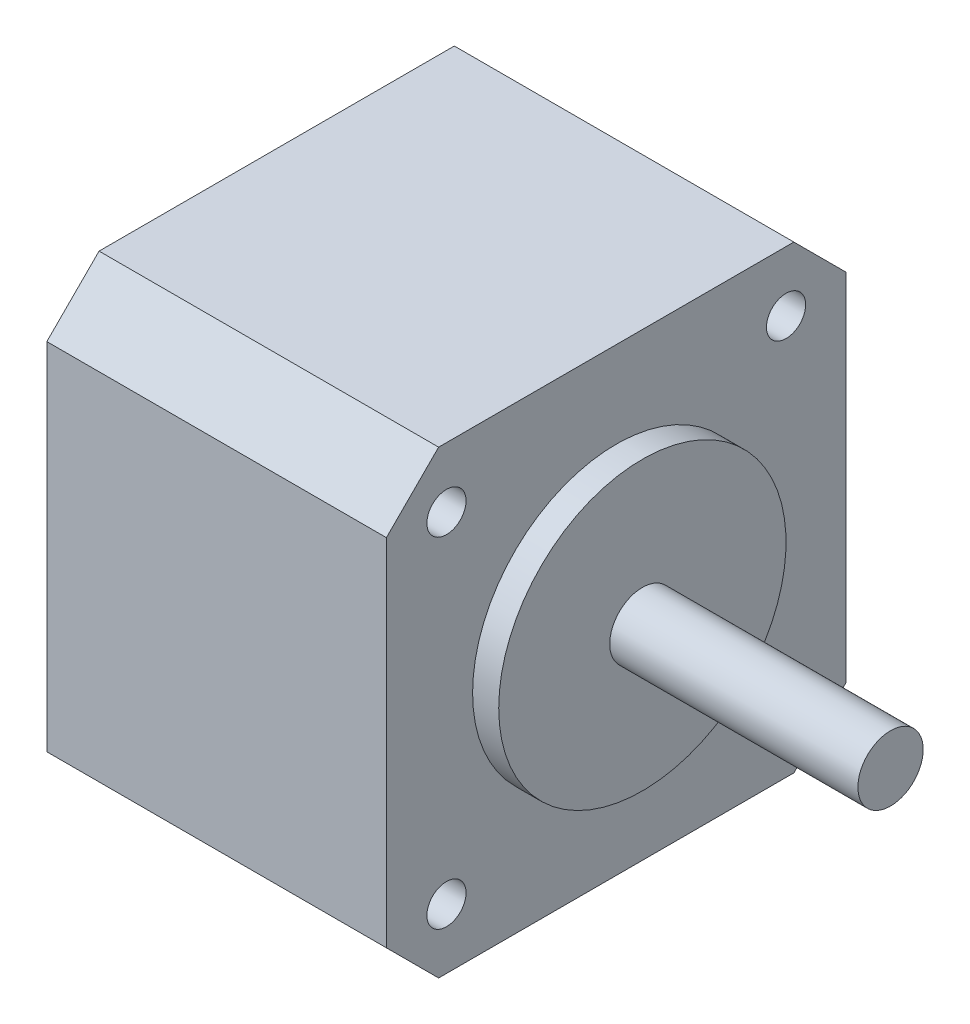
from build123d import *

# Parameters (mm, degrees)
SKETCH1_R           = 2.5
BOSS_EXTRUDE1_DEPTH = 19
SKETCH2_R           = 11
BOSS_EXTRUDE2_DEPTH = 2
SKETCH3_W           = 35.2
SKETCH3_H           = 35.2
SKETCH3_R           = 1.5
BOSS_EXTRUDE3_DEPTH = 4
SKETCH4_W           = 35.2
SKETCH4_H           = 35.2
BOSS_EXTRUDE4_DEPTH = 22
CHAMFER1_SIZE       = 4


with BuildPart() as part:
    # Sketch1 → Boss-Extrude1 (new body)
    with BuildSketch(Plane(origin=(0, 0, 0), x_dir=(0, 0, -1), z_dir=(1, 0, 0))):
        Circle(SKETCH1_R)
    extrude(amount=-BOSS_EXTRUDE1_DEPTH)

    # Sketch2 → Boss-Extrude2 (add)
    with BuildSketch(Plane.ZY.offset(19)):
        Circle(SKETCH2_R)
    extrude(amount=BOSS_EXTRUDE2_DEPTH)

    # Sketch3 → Boss-Extrude3 (add)
    with BuildSketch(Plane.ZY.offset(21)):
        Rectangle(SKETCH3_W, SKETCH3_H)
        with Locations((-13, 13)):
            Circle(SKETCH3_R, mode=Mode.SUBTRACT)
        with Locations((13, 13)):
            Circle(SKETCH3_R, mode=Mode.SUBTRACT)
        with Locations((13, -13)):
            Circle(SKETCH3_R, mode=Mode.SUBTRACT)
        with Locations((-13, -13)):
            Circle(SKETCH3_R, mode=Mode.SUBTRACT)
    extrude(amount=BOSS_EXTRUDE3_DEPTH)

    # Sketch4 → Boss-Extrude4 (add)
    with BuildSketch(Plane.ZY.offset(25)):
        Rectangle(SKETCH4_W, SKETCH4_H)
    extrude(amount=BOSS_EXTRUDE4_DEPTH)

    # Chamfer1
    chamfer1_edges = [part.edges().sort_by_distance(p)[0] for p in [
        (-34, -17.6, 17.6),
        (-34, 17.6, 17.6),
        (-34, 17.6, -17.6),
        (-34, -17.6, -17.6),
    ]]
    chamfer(chamfer1_edges, length=CHAMFER1_SIZE)


solid = part.part
